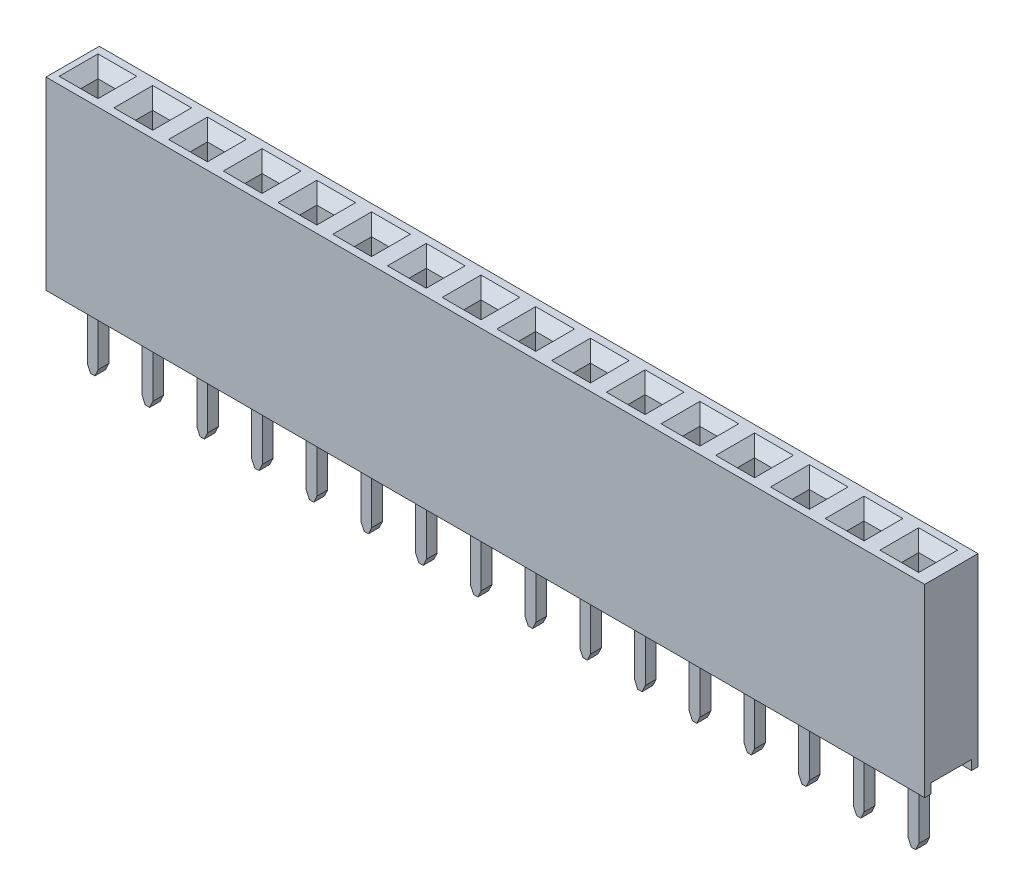
from build123d import *

# Parameters (mm, degrees)
SKETCH1_W                  = 40.79
SKETCH1_H                  = 8.575
BOSS_EXTRUDE1_DEPTH        = 1.2375
SKETCH2_W                  = 1.875
SKETCH2_H                  = 0.447874384
CUT_EXTRUDE1_DEPTH         = 50
SKETCH4_W                  = 0.8
SKETCH4_H                  = 0.8
CUT_EXTRUDE2_DEPTH         = 1.5
CHAMFER1_SIZE              = 0.5
SKETCH5_W                  = 1.8
SKETCH5_H                  = 1.8
CUT_EXTRUDE3_DEPTH         = 3
BOSS_EXTRUDE4_DEPTH        = 0.85
BOSS_EXTRUDE5_DEPTH        = 0.25
LPATTERN1_COUNT            = 16
LPATTERN1_PITCH            = 2.54
CHAMFER1_OF_LPATTERN1_SIZE = 0.5


with BuildPart() as part:
    # Sketch1 → Boss-Extrude1 (new, symmetric)
    with BuildSketch(Plane.XY):
        Rectangle(SKETCH1_W, SKETCH1_H)
    extrude(amount=BOSS_EXTRUDE1_DEPTH, both=True)

    # Sketch2 → Cut-Extrude1 (cut, symmetric)
    with BuildSketch(Plane(origin=(0, 0, 0), x_dir=(0, 0, -1), z_dir=(1, 0, 0))):
        with Locations((0, -4.063562808)):
            Rectangle(SKETCH2_W, SKETCH2_H)
    extrude(amount=CUT_EXTRUDE1_DEPTH, both=True, mode=Mode.SUBTRACT)

    # Sketch4 → Cut-Extrude2 (cut)
    with BuildSketch(Plane(origin=(0, 4.2875, 0), x_dir=(1, 0, 0), z_dir=(0, 1, 0))):
        with Locations((-19.22, 0)):
            Rectangle(SKETCH4_W, SKETCH4_H)
    cut_extrude2 = extrude(amount=-CUT_EXTRUDE2_DEPTH, mode=Mode.SUBTRACT)

    # Chamfer1
    chamfer1_edges = [part.edges().sort_by_distance(p)[0] for p in [
        (-18.82, 4.2875, 0),
        (-19.22, 4.2875, -0.4),
        (-19.62, 4.2875, 0),
        (-19.22, 4.2875, 0.4),
    ]]
    chamfer(chamfer1_edges, length=CHAMFER1_SIZE)

    # Sketch5 → Cut-Extrude3 (cut, symmetric)
    with BuildSketch(Plane(origin=(0, 0, 0), x_dir=(1, 0, 0), z_dir=(0, 1, 0))):
        with Locations((-19.22, 0)):
            Rectangle(SKETCH5_W, SKETCH5_H)
    cut_extrude3 = extrude(amount=CUT_EXTRUDE3_DEPTH, both=True, mode=Mode.SUBTRACT)

    # Sketch9 → Boss-Extrude4 (add, symmetric)
    with BuildSketch(Plane.XY):
        with BuildLine():
            Line((-18.32, -1.258559541), (-18.348014959, -1.140581312))
            Line((-18.348014959, -1.140581312), (-18.798030642, 1.57061977))
            ThreePointArc((-18.798030642, 1.57061977), (-19.051507644, 1.635939005), (-18.929425263, 1.404394008))
            Line((-18.929425263, 1.404394008), (-18.702200943, -1.906588934))
            ThreePointArc((-18.702200943, -1.906588934), (-18.852081635, -2.25095927), (-19.22, -2.326399486))
            ThreePointArc((-19.22, -2.326399486), (-19.587918365, -2.25095927), (-19.737799057, -1.906588934))
            Line((-19.737799057, -1.906588934), (-19.510574737, 1.404394008))
            ThreePointArc((-19.510574737, 1.404394008), (-19.388492356, 1.635939005), (-19.641969358, 1.57061977))
            Line((-19.641969358, 1.57061977), (-20.091985041, -1.140581312))
            Line((-20.091985041, -1.140581312), (-20.12, -1.258559541))
            Line((-20.12, -1.258559541), (-20.12, -2.610217055))
            Line((-20.12, -2.610217055), (-19.847962444, -2.970231597))
            Line((-19.847962444, -2.970231597), (-18.592037556, -2.970231597))
            Line((-18.592037556, -2.970231597), (-18.32, -2.610217055))
            Line((-18.32, -2.610217055), (-18.32, -1.258559541))
        make_face()
    boss_extrude4 = extrude(amount=BOSS_EXTRUDE4_DEPTH, both=True)

    # Sketch9<3> → Boss-Extrude5 (add, symmetric)
    with BuildSketch(Plane.XY):
        Polygon((-18.963441334, -7.25699109), (-18.963441334, -2.970231597), (-19.463441334, -2.970231597), (-19.463441334, -7.25699109), (-19.313441334, -7.578667128), (-19.113441334, -7.578667128), align=None)
    boss_extrude5 = extrude(amount=BOSS_EXTRUDE5_DEPTH, both=True)

    # LPattern1: Cut-Extrude2, Cut-Extrude3, Boss-Extrude4, Boss-Extrude5 ×16
    with Locations(*[(i * LPATTERN1_PITCH, 0, 0) for i in range(1, LPATTERN1_COUNT)]):
        add(cut_extrude2, mode=Mode.SUBTRACT)
        add(cut_extrude3, mode=Mode.SUBTRACT)
        add(boss_extrude4)
        add(boss_extrude5)

    # Chamfer1 of LPattern1
    chamfer1_of_lpattern1_edges = [part.edges().sort_by_distance(p)[0] for p in [
        (-16.28, 4.2875, 0),
        (-16.68, 4.2875, -0.4),
        (-17.08, 4.2875, 0),
        (-16.68, 4.2875, 0.4),
        (-13.74, 4.2875, 0),
        (-14.14, 4.2875, -0.4),
        (-14.54, 4.2875, 0),
        (-14.14, 4.2875, 0.4),
        (-11.2, 4.2875, 0),
        (-11.6, 4.2875, -0.4),
        (-12, 4.2875, 0),
        (-11.6, 4.2875, 0.4),
        (-8.66, 4.2875, 0),
        (-9.06, 4.2875, -0.4),
        (-9.46, 4.2875, 0),
        (-9.06, 4.2875, 0.4),
        (-6.12, 4.2875, 0),
        (-6.52, 4.2875, -0.4),
        (-6.92, 4.2875, 0),
        (-6.52, 4.2875, 0.4),
        (-3.58, 4.2875, 0),
        (-3.98, 4.2875, -0.4),
        (-4.38, 4.2875, 0),
        (-3.98, 4.2875, 0.4),
        (-1.04, 4.2875, 0),
        (-1.44, 4.2875, -0.4),
        (-1.84, 4.2875, 0),
        (-1.44, 4.2875, 0.4),
        (1.5, 4.2875, 0),
        (1.1, 4.2875, -0.4),
        (0.7, 4.2875, 0),
        (1.1, 4.2875, 0.4),
        (4.04, 4.2875, 0),
        (3.64, 4.2875, -0.4),
        (3.24, 4.2875, 0),
        (3.64, 4.2875, 0.4),
        (6.58, 4.2875, 0),
        (6.18, 4.2875, -0.4),
        (5.78, 4.2875, 0),
        (6.18, 4.2875, 0.4),
        (9.12, 4.2875, 0),
        (8.72, 4.2875, -0.4),
        (8.32, 4.2875, 0),
        (8.72, 4.2875, 0.4),
        (11.66, 4.2875, 0),
        (11.26, 4.2875, -0.4),
        (10.86, 4.2875, 0),
        (11.26, 4.2875, 0.4),
        (14.2, 4.2875, 0),
        (13.8, 4.2875, -0.4),
        (13.4, 4.2875, 0),
        (13.8, 4.2875, 0.4),
        (16.74, 4.2875, 0),
        (16.34, 4.2875, -0.4),
        (15.94, 4.2875, 0),
        (16.34, 4.2875, 0.4),
        (19.28, 4.2875, 0),
        (18.88, 4.2875, -0.4),
        (18.48, 4.2875, 0),
        (18.88, 4.2875, 0.4),
    ]]
    chamfer(chamfer1_of_lpattern1_edges, length=CHAMFER1_OF_LPATTERN1_SIZE)


solid = part.part
